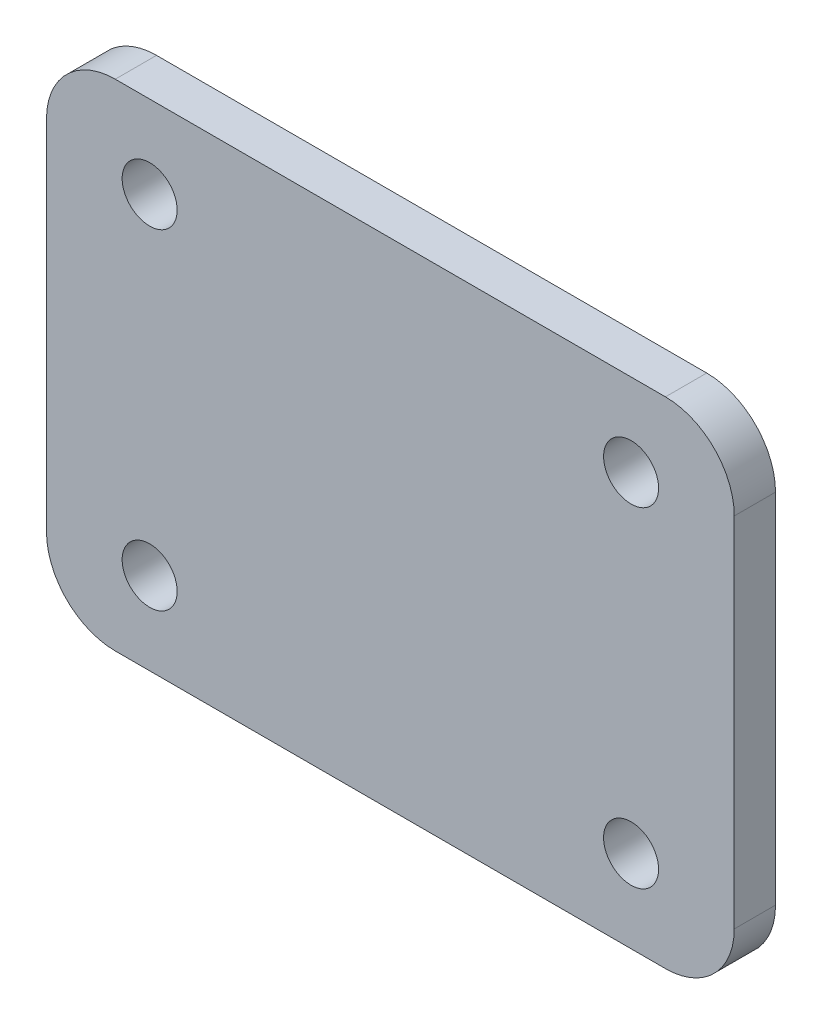
from build123d import *

# Parameters (mm, degrees)
SKETCH_1_W      = 50
SKETCH_1_H      = 36
SKETCH_1_R      = 2
EXTRUDE_1_DEPTH = 3
FILLET_1_R      = 5


with BuildPart() as part:
    # 草图1 → 凸台-拉伸1 (new body)
    with BuildSketch(Plane.XY):
        Rectangle(SKETCH_1_W, SKETCH_1_H)
        with Locations((17.5, -12)):
            Circle(SKETCH_1_R, mode=Mode.SUBTRACT)
        with Locations((-17.5, -12)):
            Circle(SKETCH_1_R, mode=Mode.SUBTRACT)
        with Locations((17.5, 12)):
            Circle(SKETCH_1_R, mode=Mode.SUBTRACT)
        with Locations((-17.5, 12)):
            Circle(SKETCH_1_R, mode=Mode.SUBTRACT)
    extrude(amount=EXTRUDE_1_DEPTH)

    # 圆角1
    fillet_1_edges = [part.edges().sort_by_distance(p)[0] for p in [
        (25, -18, 1.5),
        (-25, -18, 1.5),
        (-25, 18, 1.5),
        (25, 18, 1.5),
    ]]
    fillet(fillet_1_edges, radius=FILLET_1_R)


solid = part.part
